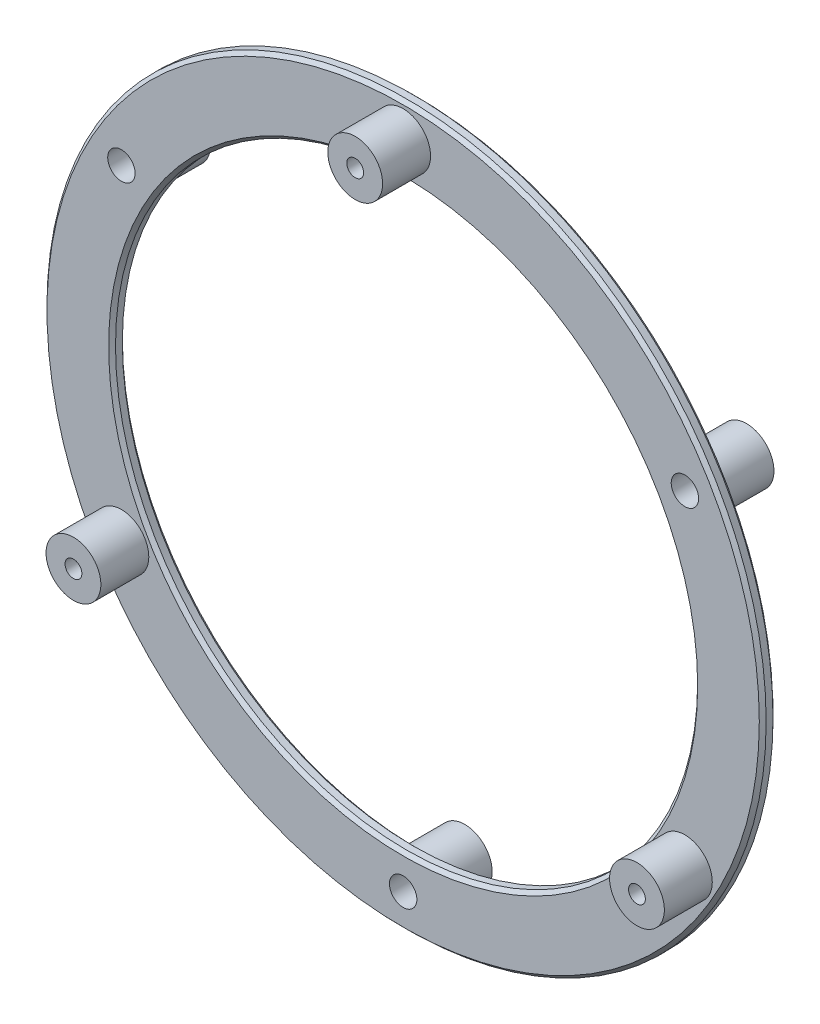
from build123d import *

# Parameters (mm, degrees)
SKETCH1_W                 = 52.5
SKETCH1_H                 = 2
SKETCH2_W                 = 4
SKETCH2_H                 = 7
SKETCH3_W                 = 4
SKETCH3_H                 = 7
SKETCH4_W                 = 4
SKETCH4_H                 = 7
SKETCH5_W                 = 4
SKETCH5_H                 = 7
SKETCH6_W                 = 4
SKETCH6_H                 = 7
SKETCH7_W                 = 4
SKETCH7_H                 = 7
F_4_0_4_DIAMETER_HOLE1_D  = 4
M80_CLEARANCE_HOLE1_D     = 85
M80_CLEARANCE_HOLE1_DEPTH = 9
CHAMFER1_SIZE             = 0.5


with BuildPart() as part:
    # Sketch1 → Revolve1 (revolve)
    with BuildSketch(Plane.XZ, mode=Mode.PRIVATE) as revolve1_sk:
        with Locations((26.25, 1)):
            Rectangle(SKETCH1_W, SKETCH1_H)
    revolve(revolve1_sk.sketch.rotate(Axis((0, 0, 2), (0, 0, -1)), 180), axis=Axis((0, 0, 2), (0, 0, -1)))

    # Sketch2 → Revolve2 (revolve)
    with BuildSketch(Plane.XZ.offset(23.75), mode=Mode.PRIVATE) as revolve2_sk:
        with Locations((43.13620668, 5.5)):
            Rectangle(SKETCH2_W, SKETCH2_H)
    revolve(revolve2_sk.sketch.rotate(Axis((41.13620668, -23.75, 9), (0, 0, -1)), 180), axis=Axis((41.13620668, -23.75, 9), (0, 0, -1)))

    # Sketch3 → Revolve3 (revolve)
    with BuildSketch(Plane.XZ.offset(23.75), mode=Mode.PRIVATE) as revolve3_sk:
        with Locations((-39.13620668, 5.5)):
            Rectangle(SKETCH3_W, SKETCH3_H)
    revolve(revolve3_sk.sketch.rotate(Axis((-41.13620668, -23.75, 9), (0, 0, -1)), 180), axis=Axis((-41.13620668, -23.75, 9), (0, 0, -1)))

    # Sketch4 → Revolve4 (revolve)
    with BuildSketch(Plane.XZ.offset(-47.5), mode=Mode.PRIVATE) as revolve4_sk:
        with Locations((2, 5.5)):
            Rectangle(SKETCH4_W, SKETCH4_H)
    revolve(revolve4_sk.sketch.rotate(Axis((0, 47.5, 9), (0, 0, -1)), 180), axis=Axis((0, 47.5, 9), (0, 0, -1)))

    # Sketch5 → Revolve5 (revolve)
    with BuildSketch(Plane(origin=(0, 23.75, 0), x_dir=(1, 0, 0), z_dir=(0, 1, 0))):
        with Locations((43.13620668, 3.5)):
            Rectangle(SKETCH5_W, SKETCH5_H)
    revolve(axis=Axis((41.13620668, 23.75, -7), (0, 0, 1)))

    # Sketch6 → Revolve6 (revolve)
    with BuildSketch(Plane(origin=(0, 23.75, 0), x_dir=(1, 0, 0), z_dir=(0, 1, 0))):
        with Locations((-39.13620668, 3.5)):
            Rectangle(SKETCH6_W, SKETCH6_H)
    revolve(axis=Axis((-41.13620668, 23.75, -7), (0, 0, 1)))

    # Sketch7 → Revolve7 (revolve)
    with BuildSketch(Plane(origin=(0, -47.5, 0), x_dir=(1, 0, 0), z_dir=(0, 1, 0))):
        with Locations((2, 3.5)):
            Rectangle(SKETCH7_W, SKETCH7_H)
    revolve(axis=Axis((0, -47.5, -7), (0, 0, 1)))

    # Sketch8 → Cut-Revolve1 (revolve, cut)
    with BuildSketch(Plane(origin=(0, 47.5, 0), x_dir=(1, 0, 0), z_dir=(0, 1, 0))):
        Polygon((1.2295, 0), (0, 0), (0, -9), (1.2295, -9), (1.2295, -7), align=None)
    revolve(axis=Axis((0, 47.5, 0), (0, 0, 1)), mode=Mode.SUBTRACT)

    # Sketch9 → Cut-Revolve2 (revolve, cut)
    with BuildSketch(Plane(origin=(0, -23.75, 0), x_dir=(1, 0, 0), z_dir=(0, 1, 0))):
        Polygon((-39.90670668, 0), (-41.13620668, 0), (-41.13620668, -9), (-39.90670668, -9), (-39.90670668, -7), align=None)
    revolve(axis=Axis((-41.13620668, -23.75, 0), (0, 0, 1)), mode=Mode.SUBTRACT)

    # Sketch10 → Cut-Revolve3 (revolve, cut)
    with BuildSketch(Plane(origin=(0, -23.75, 0), x_dir=(1, 0, 0), z_dir=(0, 1, 0))):
        Polygon((42.36570668, 0), (41.13620668, 0), (41.13620668, -9), (42.36570668, -9), (42.36570668, -7), align=None)
    revolve(axis=Axis((41.13620668, -23.75, 0), (0, 0, 1)), mode=Mode.SUBTRACT)

    # Ø4.0 (4) Diameter Hole1 (through all)
    with Locations(Plane(origin=(0, 0, -7), x_dir=(-1, 0, 0), z_dir=(0, 0, -1))):
        with Locations((-41.13620668, 23.75), (0, -47.5), (41.13620668, 23.75)):
            Hole(F_4_0_4_DIAMETER_HOLE1_D / 2)

    # M80 Clearance Hole1
    with Locations(Plane.XY.offset(2)):
        with Locations((0, 0)):
            Hole(M80_CLEARANCE_HOLE1_D / 2, depth=M80_CLEARANCE_HOLE1_DEPTH)

    # Chamfer1
    chamfer1_edges = [part.edges().sort_by_distance(p)[0] for p in [
        (52.5, 0, 0),
        (52.5, 0, 2),
        (42.5, 0, 0),
        (42.5, 0, 2),
    ]]
    chamfer(chamfer1_edges, length=CHAMFER1_SIZE)


solid = part.part
